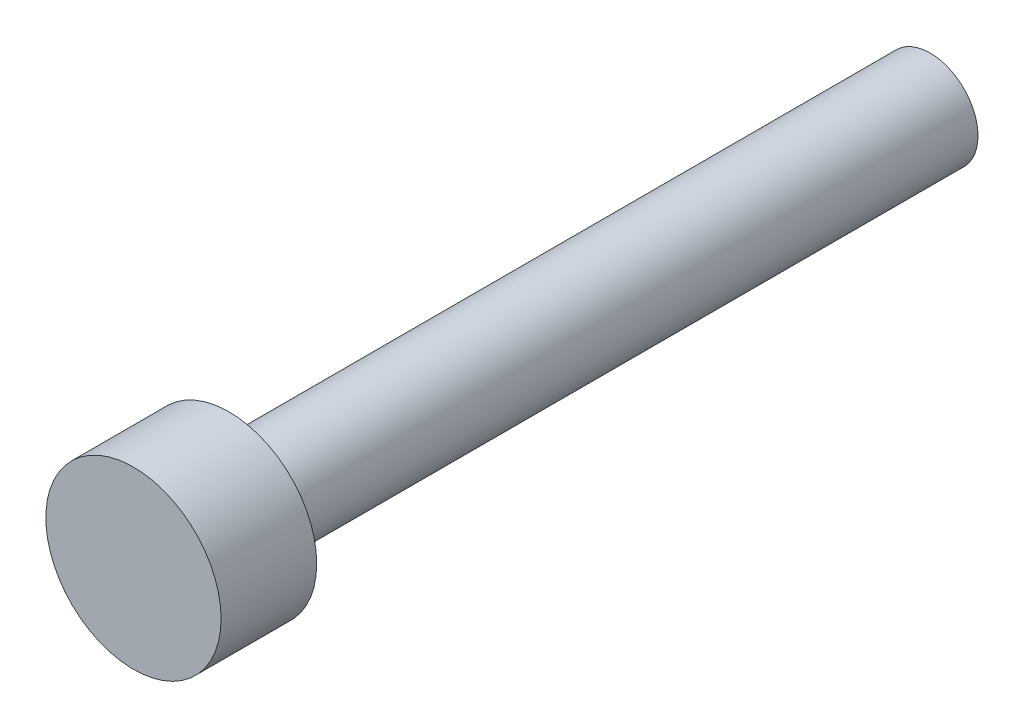
from build123d import *

# Parameters (mm, degrees)
NOMINAL_SHANK_START    = -22
SKETCH_NOMINAL_SHANK_R = 1.5
NOMINAL_SHANK_DEPTH    = 22
SKETCH_HEAD_R          = 2.75
HEAD_DEPTH             = 3


with BuildPart() as part:
    # Sketch_Nominal_shank → Nominal_shank (new body)
    with BuildSketch(Plane.XY.offset(NOMINAL_SHANK_START)):
        Circle(SKETCH_NOMINAL_SHANK_R)
    extrude(amount=NOMINAL_SHANK_DEPTH)

    # Sketch_Head → Head (add)
    with BuildSketch(Plane.XY):
        Circle(SKETCH_HEAD_R)
    extrude(amount=HEAD_DEPTH)


solid = part.part
